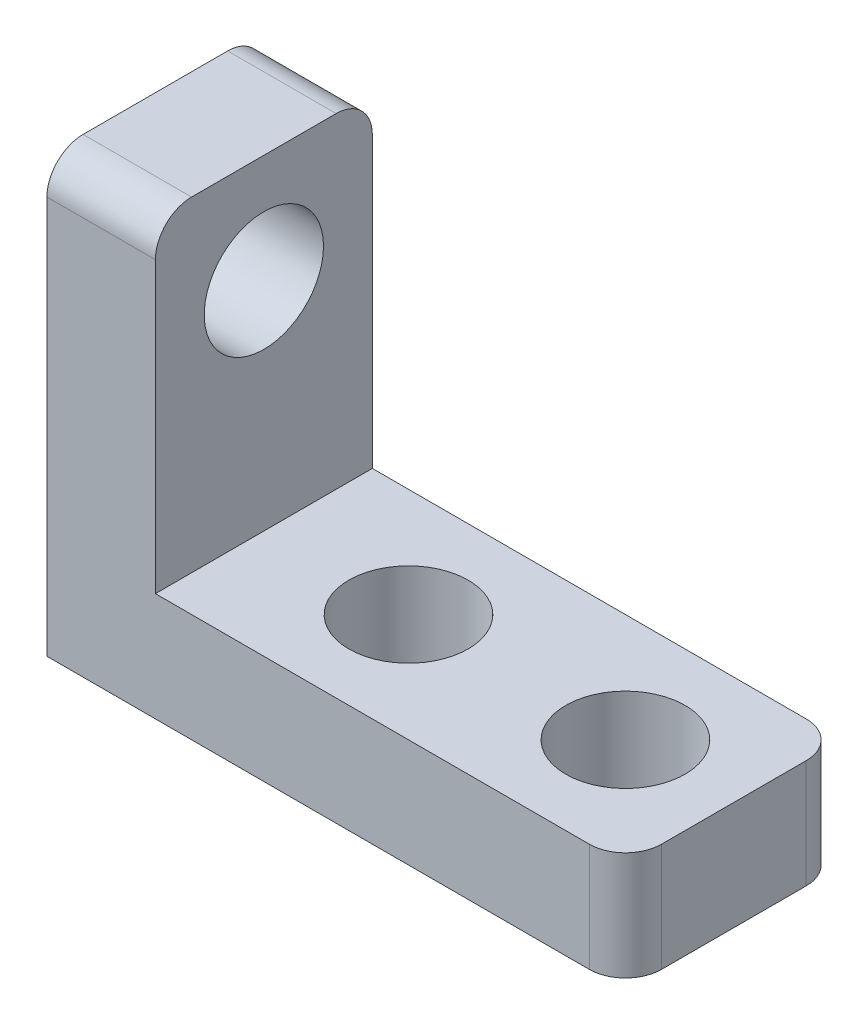
from build123d import *

# Parameters (mm, degrees)
EXTRUDE_1_DEPTH     = 6
SKETCH_2_R          = 1.65
CUT_EXTRUDE_1_DEPTH = 6
SKETCH_3_R          = 1.65
CUT_EXTRUDE_2_DEPTH = 6
FILLET_1_R          = 1


with BuildPart() as part:
    # 草图1 → 凸台-拉伸1 (new body)
    with BuildSketch(Plane.XY):
        Polygon((0, 0), (16, 0), (16, 3), (3, 3), (3, 12), (0, 12), align=None)
    extrude(amount=EXTRUDE_1_DEPTH)

    # 草图2 → 切除-拉伸1 (cut)
    with BuildSketch(Plane(origin=(3, 0, 0), x_dir=(0, 0, -1), z_dir=(1, 0, 0))):
        with Locations((-3, 9)):
            Circle(SKETCH_2_R)
    extrude(amount=-CUT_EXTRUDE_1_DEPTH, mode=Mode.SUBTRACT)

    # 草图3 → 切除-拉伸2 (cut)
    with BuildSketch(Plane(origin=(0, 3, 0), x_dir=(1, 0, 0), z_dir=(0, 1, 0))):
        with Locations(Location((7, -3, 0), (0, 0, 270))):
            Circle(SKETCH_3_R)
        with Locations(Location((13, -3, 0), (0, 0, 270))):
            Circle(SKETCH_3_R)
    extrude(amount=-CUT_EXTRUDE_2_DEPTH, mode=Mode.SUBTRACT)

    # 圆角1
    fillet_1_edges = [part.edges().sort_by_distance(p)[0] for p in [
        (16, 1.5, 6),
        (1.5, 12, 6),
        (1.5, 12, 0),
        (16, 1.5, 0),
    ]]
    fillet(fillet_1_edges, radius=FILLET_1_R)


solid = part.part
